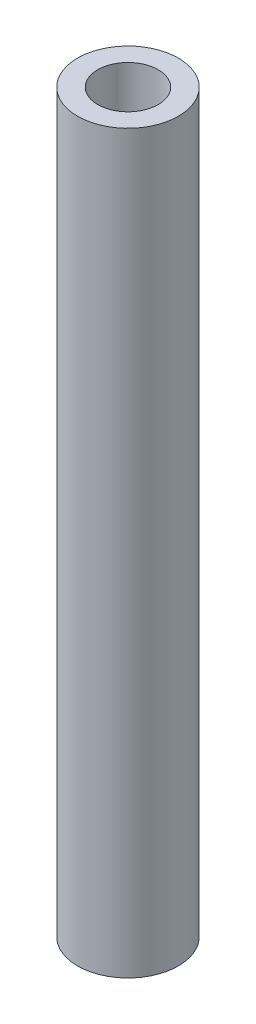
from build123d import *

# Parameters (mm, degrees)
SKETCH1_R           = 5
SKETCH1_R_2         = 3
BOSS_EXTRUDE1_DEPTH = 73


with BuildPart() as part:
    # Sketch1 → Boss-Extrude1 (new body)
    with BuildSketch(Plane(origin=(0, 0, 0), x_dir=(1, 0, 0), z_dir=(0, 1, 0))):
        with Locations(Location((0, 0, 0), (0, 0, 270))):
            Circle(SKETCH1_R)
        with Locations(Location((0, 0, 0), (0, 0, 270))):
            Circle(SKETCH1_R_2, mode=Mode.SUBTRACT)
    extrude(amount=BOSS_EXTRUDE1_DEPTH)


solid = part.part
